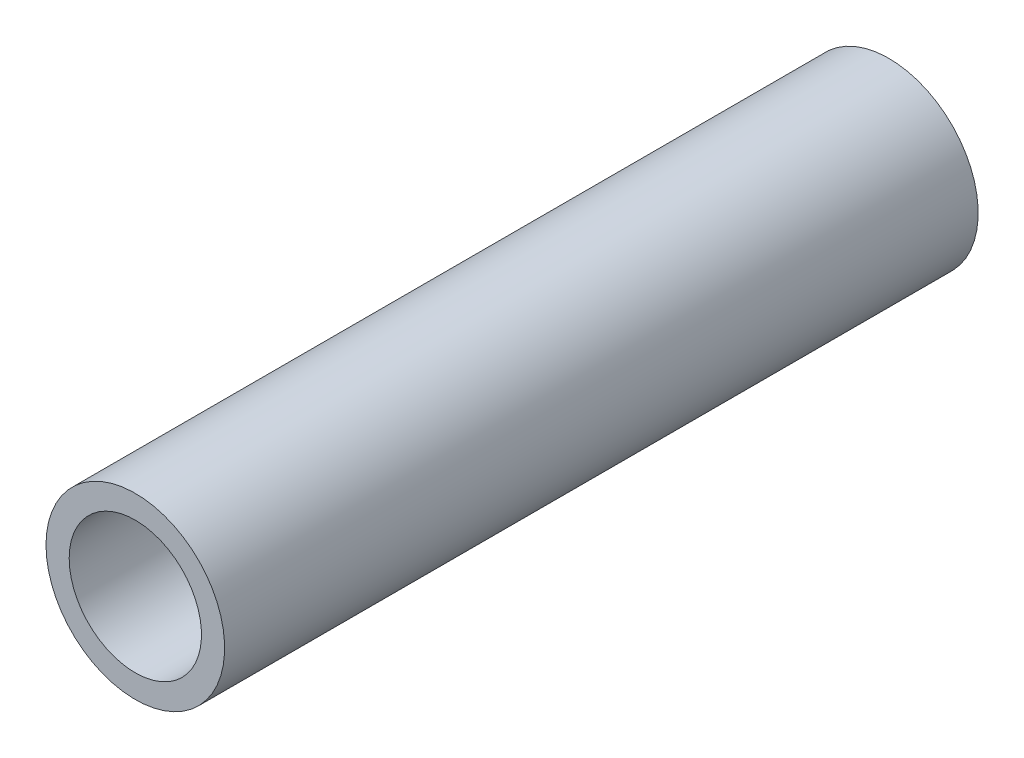
from build123d import *

# Parameters (mm, degrees)
SKETCH1_R           = 10.668
SKETCH1_R_2         = 7.8994
EXTRUDE_THIN1_DEPTH = 45


with BuildPart() as part:
    # Sketch1 → Extrude-Thin1 (new, symmetric)
    with BuildSketch(Plane.XY):
        Circle(SKETCH1_R)
        Circle(SKETCH1_R_2, mode=Mode.SUBTRACT)
    extrude(amount=EXTRUDE_THIN1_DEPTH, both=True)


solid = part.part
